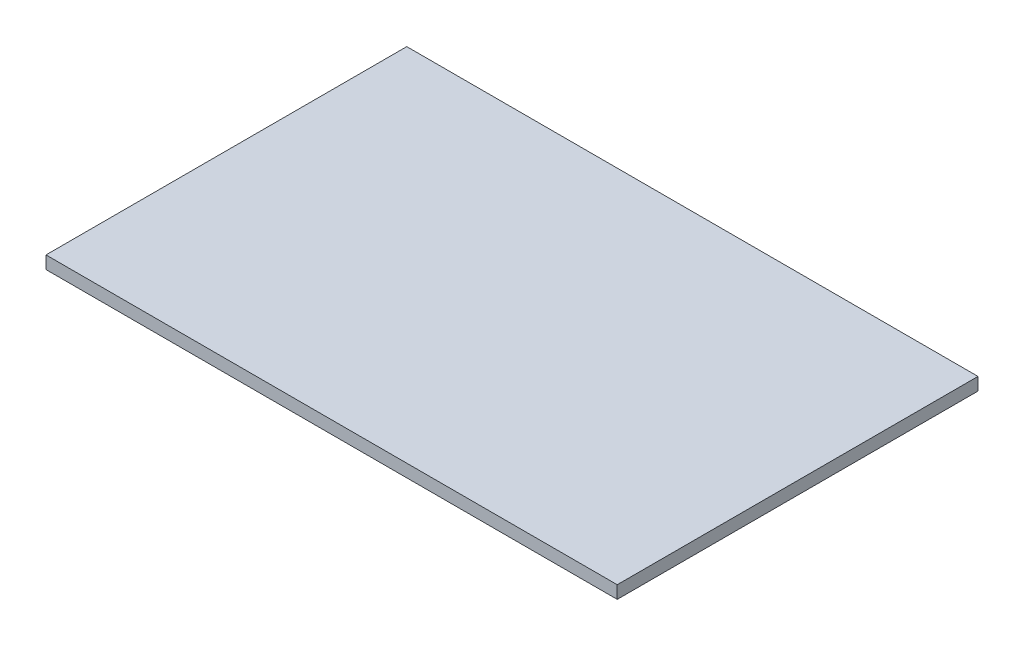
from build123d import *

# Parameters (mm, degrees)
SKETCH1_W           = 784.225
SKETCH1_H           = 495.3
BOSS_EXTRUDE1_DEPTH = 17.4625


with BuildPart() as part:
    # Sketch1 → Boss-Extrude1 (new body)
    with BuildSketch(Plane(origin=(0, 0, 0), x_dir=(1, 0, 0), z_dir=(0, 1, 0))):
        with Locations((392.1125, 247.65)):
            Rectangle(SKETCH1_W, SKETCH1_H)
    extrude(amount=BOSS_EXTRUDE1_DEPTH)


solid = part.part
